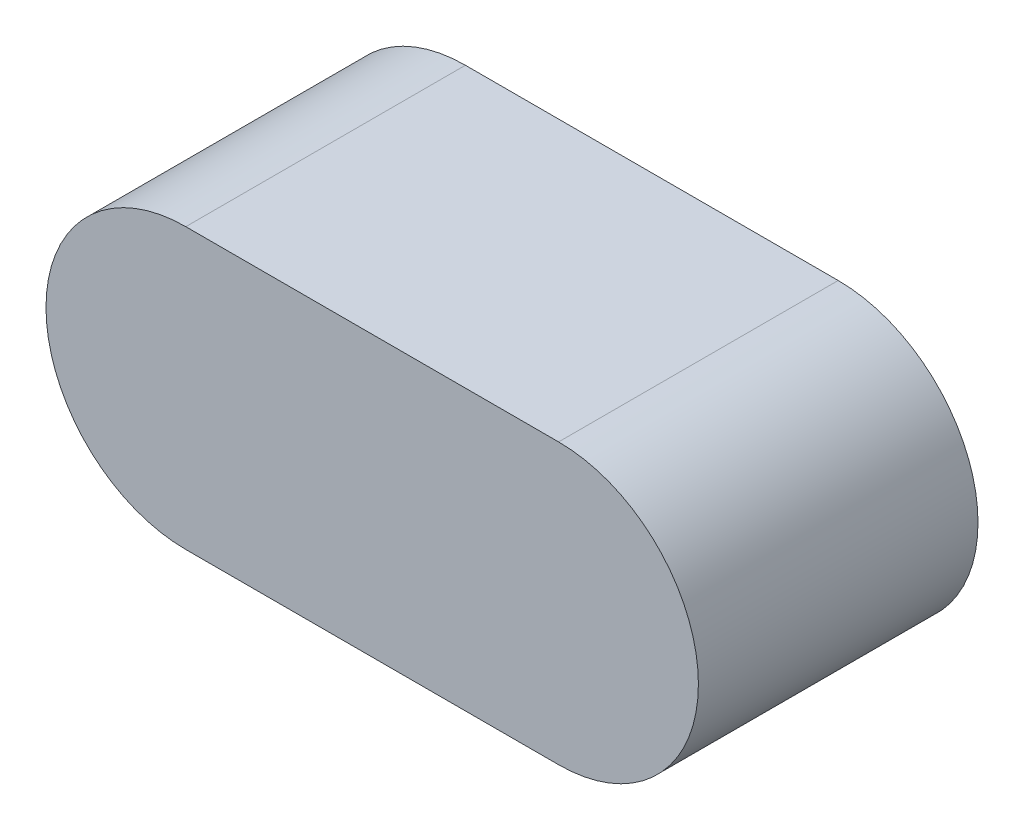
from build123d import *

# Parameters (mm, degrees)
BOSS_EXTRUDE1_DEPTH = 3


with BuildPart() as part:
    # Sketch1 → Boss-Extrude1 (new body)
    with BuildSketch(Plane.XY):
        with BuildLine():
            Line((0, 1.5), (4, 1.5))
            ThreePointArc((4, 1.5), (5.5, 0), (4, -1.5))
            Line((4, -1.5), (0, -1.5))
            ThreePointArc((0, -1.5), (-1.5, 0), (0, 1.5))
        make_face()
    extrude(amount=BOSS_EXTRUDE1_DEPTH)


solid = part.part
